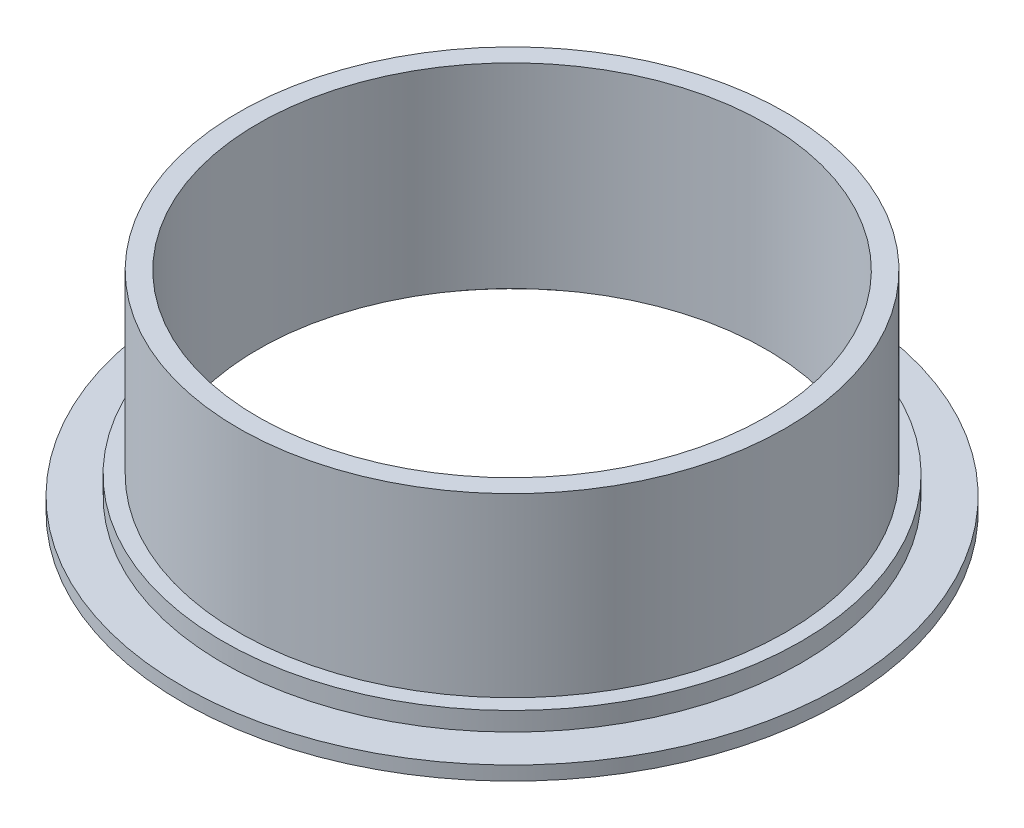
from build123d import *


with BuildPart() as part:
    # Sketch1 → Revolve1 (revolve)
    with BuildSketch(Plane.XY, mode=Mode.PRIVATE) as revolve1_sk:
        Polygon((-650, 535.75794621), (-650, 35.75794621), (-700, 35.75794621), (-700, 0), (-740, 0), (-843.170504669, 0), (-843.170504669, 35.75794621), (-740, 35.75794621), (-740, 83.63305874), (-700, 83.63305874), (-700, 535.75794621), align=None)
    revolve(revolve1_sk.sketch.rotate(Axis((0, -8382.840526503, 0), (0, 1, 0)), 180), axis=Axis((0, -8382.840526503, 0), (0, 1, 0)))


solid = part.part
